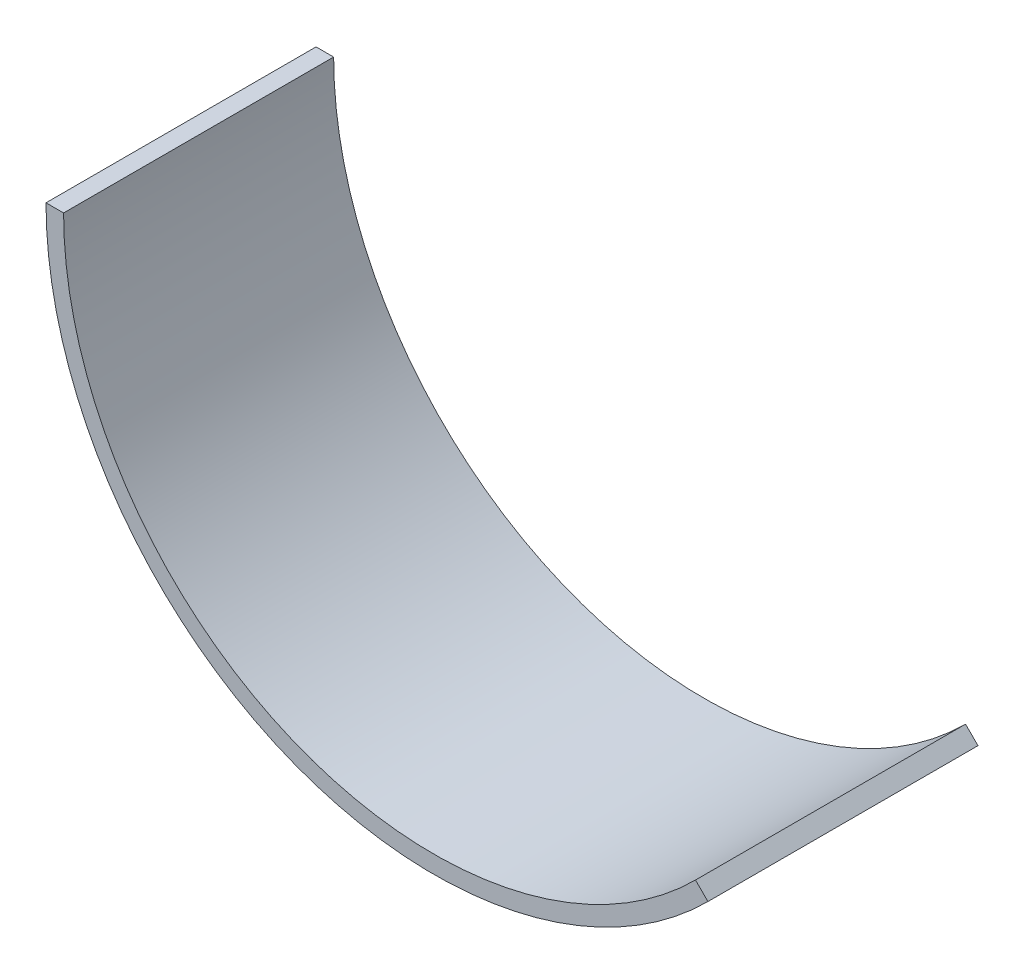
from build123d import *

# Parameters (mm, degrees)
BOSS_EXTRUDE1_DEPTH = 50.699999946


with BuildPart() as part:
    # Sketch1 → Boss-Extrude1 (new body)
    with BuildSketch(Plane.XY):
        with BuildLine():
            Line((-72.797999946, 0), (-69.495999946, 0))
            ThreePointArc((-69.495999946, 0), (-26.594967795, -64.205931942), (49.141092827, -49.141092827))
            Line((49.141092827, -49.141092827), (51.475959419, -51.475959419))
            ThreePointArc((51.475959419, -51.475959419), (-27.858588489, -67.256582158), (-72.797999946, 0))
        make_face()
    extrude(amount=BOSS_EXTRUDE1_DEPTH)


solid = part.part
